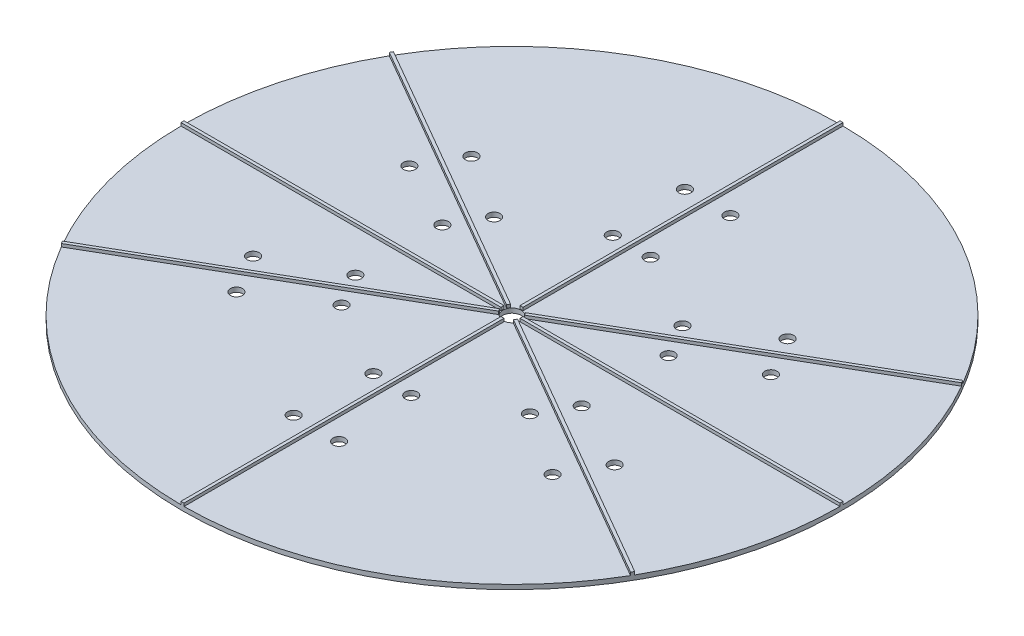
from build123d import *

# Parameters (mm, degrees)
SKETCH1_R           = 217.5
SKETCH1_R_2         = 4
SKETCH1_R_3         = 6
BOSS_EXTRUDE1_DEPTH = 2.5
CUT_EXTRUDE1_START  = -2
SKETCH2_R           = 4
SKETCH2_R_2         = 6
CUT_EXTRUDE1_DEPTH  = 2


with BuildPart() as part:
    # Sketch1 → Boss-Extrude1 (new, symmetric)
    with BuildSketch(Plane(origin=(0, 0, 0), x_dir=(1, 0, 0), z_dir=(0, 1, 0))):
        with Locations(Location((0, 0, 0), (0, 0, 270))):
            Circle(SKETCH1_R)
        with Locations(Location((-12.5, 79.017403146, 0), (0, 0, 270))):
            Circle(SKETCH1_R_2, mode=Mode.SUBTRACT)
        with Locations(Location((12.5, 79.017403146, 0), (0, 0, 270))):
            Circle(SKETCH1_R_2, mode=Mode.SUBTRACT)
        with Locations(Location((62.181078466, 50.334019121, 0), (0, 0, 270))):
            Circle(SKETCH1_R_2, mode=Mode.SUBTRACT)
        with Locations(Location((74.681078466, 28.683384026, 0), (0, 0, 270))):
            Circle(SKETCH1_R_2, mode=Mode.SUBTRACT)
        with Locations(Location((74.681078466, -28.683384026, 0), (0, 0, 270))):
            Circle(SKETCH1_R_2, mode=Mode.SUBTRACT)
        with Locations(Location((62.181078466, -50.334019121, 0), (0, 0, 270))):
            Circle(SKETCH1_R_2, mode=Mode.SUBTRACT)
        with Locations(Location((12.5, -79.017403146, 0), (0, 0, 270))):
            Circle(SKETCH1_R_2, mode=Mode.SUBTRACT)
        with Locations(Location((-12.5, -79.017403146, 0), (0, 0, 270))):
            Circle(SKETCH1_R_2, mode=Mode.SUBTRACT)
        with Locations(Location((-62.181078466, -50.334019121, 0), (0, 0, 270))):
            Circle(SKETCH1_R_2, mode=Mode.SUBTRACT)
        with Locations(Location((-74.681078466, -28.683384026, 0), (0, 0, 270))):
            Circle(SKETCH1_R_2, mode=Mode.SUBTRACT)
        with Locations(Location((-74.681078466, 28.683384026, 0), (0, 0, 270))):
            Circle(SKETCH1_R_2, mode=Mode.SUBTRACT)
        with Locations(Location((-62.181078466, 50.334019121, 0), (0, 0, 270))):
            Circle(SKETCH1_R_2, mode=Mode.SUBTRACT)
        with Locations(Location((15, 129.131715701, 0), (0, 0, 270))):
            Circle(SKETCH1_R_2, mode=Mode.SUBTRACT)
        with Locations(Location((-15, 129.131715701, 0), (0, 0, 90))):
            Circle(SKETCH1_R_2, mode=Mode.SUBTRACT)
        with Locations(Location((104.331346232, 77.556238907, 0), (0, 0, 90))):
            Circle(SKETCH1_R_2, mode=Mode.SUBTRACT)
        with Locations(Location((119.331346232, 51.575476794, 0), (0, 0, 270))):
            Circle(SKETCH1_R_2, mode=Mode.SUBTRACT)
        with Locations(Location((119.331346232, -51.575476794, 0), (0, 0, 90))):
            Circle(SKETCH1_R_2, mode=Mode.SUBTRACT)
        with Locations(Location((104.331346232, -77.556238907, 0), (0, 0, 270))):
            Circle(SKETCH1_R_2, mode=Mode.SUBTRACT)
        with Locations(Location((15, -129.131715701, 0), (0, 0, 90))):
            Circle(SKETCH1_R_2, mode=Mode.SUBTRACT)
        with Locations(Location((-15, -129.131715701, 0), (0, 0, 270))):
            Circle(SKETCH1_R_2, mode=Mode.SUBTRACT)
        with Locations(Location((-104.331346232, -77.556238907, 0), (0, 0, 90))):
            Circle(SKETCH1_R_2, mode=Mode.SUBTRACT)
        with Locations(Location((-119.331346232, -51.575476794, 0), (0, 0, 270))):
            Circle(SKETCH1_R_2, mode=Mode.SUBTRACT)
        with Locations(Location((-119.331346232, 51.575476794, 0), (0, 0, 90))):
            Circle(SKETCH1_R_2, mode=Mode.SUBTRACT)
        with Locations(Location((-104.331346232, 77.556238907, 0), (0, 0, 270))):
            Circle(SKETCH1_R_2, mode=Mode.SUBTRACT)
        with Locations(Location((0, 0, 0), (0, 0, 270))):
            Circle(SKETCH1_R_3, mode=Mode.SUBTRACT)
    extrude(amount=BOSS_EXTRUDE1_DEPTH, both=True)

    # Sketch2 → Cut-Extrude1 (cut)
    with BuildSketch(Plane(origin=(0, 2.5, 0), x_dir=(1, 0, 0), z_dir=(0, 1, 0)).offset(CUT_EXTRUDE1_START)):
        with BuildLine():
            ThreePointArc((-217.497701137, -1), (-210.088867218, -56.29314231), (-188.85853445, -107.882825165))
            Line((-188.85853445, -107.882825165), (-5.888022785, -2.244751001))
            ThreePointArc((-5.888022785, -2.244751001), (-5.457177799, -3.150703071), (-4.888022785, -3.976801809))
            Line((-4.888022785, -3.976801809), (-187.85853445, -109.614875972))
            ThreePointArc((-187.85853445, -109.614875972), (-108.75, -188.360525323), (-1, -217.497701137))
            Line((-1, -217.497701137), (-1, -6.22155281))
            ThreePointArc((-1, -6.22155281), (0, -6.301406142), (1, -6.22155281))
            Line((1, -6.22155281), (1, -217.497701137))
            ThreePointArc((1, -217.497701137), (108.75, -188.360525323), (187.85853445, -109.614875972))
            Line((187.85853445, -109.614875972), (4.888022785, -3.976801809))
            ThreePointArc((4.888022785, -3.976801809), (5.457177799, -3.150703071), (5.888022785, -2.244751001))
            Line((5.888022785, -2.244751001), (188.85853445, -107.882825165))
            ThreePointArc((188.85853445, -107.882825165), (210.088867218, -56.29314231), (217.497701137, -1))
            Line((217.497701137, -1), (6.22155281, -1))
            ThreePointArc((6.22155281, -1), (6.301406142, 0), (6.22155281, 1))
            Line((6.22155281, 1), (217.497701137, 1))
            ThreePointArc((217.497701137, 1), (210.088867218, 56.29314231), (188.85853445, 107.882825165))
            Line((188.85853445, 107.882825165), (5.888022785, 2.244751001))
            ThreePointArc((5.888022785, 2.244751001), (5.457177799, 3.150703071), (4.888022785, 3.976801809))
            Line((4.888022785, 3.976801809), (187.85853445, 109.614875972))
            ThreePointArc((187.85853445, 109.614875972), (108.75, 188.360525323), (1, 217.497701137))
            Line((1, 217.497701137), (1, 6.22155281))
            ThreePointArc((1, 6.22155281), (0, 6.301406142), (-1, 6.22155281))
            Line((-1, 6.22155281), (-1, 217.497701137))
            ThreePointArc((-1, 217.497701137), (-108.75, 188.360525323), (-187.85853445, 109.614875972))
            Line((-187.85853445, 109.614875972), (-4.888022785, 3.976801809))
            ThreePointArc((-4.888022785, 3.976801809), (-5.457177799, 3.150703071), (-5.888022785, 2.244751001))
            Line((-5.888022785, 2.244751001), (-188.85853445, 107.882825165))
            ThreePointArc((-188.85853445, 107.882825165), (-210.088867218, 56.29314231), (-217.497701137, 1))
            Line((-217.497701137, 1), (-6.22155281, 1))
            ThreePointArc((-6.22155281, 1), (-6.301406142, 0), (-6.22155281, -1))
            Line((-6.22155281, -1), (-217.497701137, -1))
        make_face()
        with Locations(Location((-15, -129.131715701, 0), (0, 0, 270))):
            Circle(SKETCH2_R, mode=Mode.SUBTRACT)
        with Locations(Location((-119.331346232, -51.575476794, 0), (0, 0, 270))):
            Circle(SKETCH2_R, mode=Mode.SUBTRACT)
        with Locations(Location((-104.331346232, -77.556238907, 0), (0, 0, 90))):
            Circle(SKETCH2_R, mode=Mode.SUBTRACT)
        with Locations(Location((-12.5, -79.017403146, 0), (0, 0, 270))):
            Circle(SKETCH2_R, mode=Mode.SUBTRACT)
        with Locations(Location((-62.181078466, -50.334019121, 0), (0, 0, 270))):
            Circle(SKETCH2_R, mode=Mode.SUBTRACT)
        with Locations(Location((-74.681078466, -28.683384026, 0), (0, 0, 270))):
            Circle(SKETCH2_R, mode=Mode.SUBTRACT)
        with Locations(Location((15, -129.131715701, 0), (0, 0, 90))):
            Circle(SKETCH2_R, mode=Mode.SUBTRACT)
        with Locations(Location((12.5, -79.017403146, 0), (0, 0, 270))):
            Circle(SKETCH2_R, mode=Mode.SUBTRACT)
        with Locations(Location((104.331346232, -77.556238907, 0), (0, 0, 270))):
            Circle(SKETCH2_R, mode=Mode.SUBTRACT)
        with Locations(Location((62.181078466, -50.334019121, 0), (0, 0, 270))):
            Circle(SKETCH2_R, mode=Mode.SUBTRACT)
        with Locations(Location((74.681078466, -28.683384026, 0), (0, 0, 270))):
            Circle(SKETCH2_R, mode=Mode.SUBTRACT)
        with Locations(Location((119.331346232, -51.575476794, 0), (0, 0, 90))):
            Circle(SKETCH2_R, mode=Mode.SUBTRACT)
        with Locations(Location((-119.331346232, 51.575476794, 0), (0, 0, 90))):
            Circle(SKETCH2_R, mode=Mode.SUBTRACT)
        with Locations(Location((-74.681078466, 28.683384026, 0), (0, 0, 270))):
            Circle(SKETCH2_R, mode=Mode.SUBTRACT)
        with Locations(Location((-62.181078466, 50.334019121, 0), (0, 0, 270))):
            Circle(SKETCH2_R, mode=Mode.SUBTRACT)
        with Locations(Location((-104.331346232, 77.556238907, 0), (0, 0, 270))):
            Circle(SKETCH2_R, mode=Mode.SUBTRACT)
        with Locations(Location((-12.5, 79.017403146, 0), (0, 0, 270))):
            Circle(SKETCH2_R, mode=Mode.SUBTRACT)
        with Locations(Location((-15, 129.131715701, 0), (0, 0, 90))):
            Circle(SKETCH2_R, mode=Mode.SUBTRACT)
        with Locations(Location((0, 0, 0), (0, 0, 270))):
            Circle(SKETCH2_R_2, mode=Mode.SUBTRACT)
        with Locations(Location((74.681078466, 28.683384026, 0), (0, 0, 270))):
            Circle(SKETCH2_R, mode=Mode.SUBTRACT)
        with Locations(Location((62.181078466, 50.334019121, 0), (0, 0, 270))):
            Circle(SKETCH2_R, mode=Mode.SUBTRACT)
        with Locations(Location((12.5, 79.017403146, 0), (0, 0, 270))):
            Circle(SKETCH2_R, mode=Mode.SUBTRACT)
        with Locations(Location((104.331346232, 77.556238907, 0), (0, 0, 90))):
            Circle(SKETCH2_R, mode=Mode.SUBTRACT)
        with Locations(Location((119.331346232, 51.575476794, 0), (0, 0, 270))):
            Circle(SKETCH2_R, mode=Mode.SUBTRACT)
        with Locations(Location((15, 129.131715701, 0), (0, 0, 270))):
            Circle(SKETCH2_R, mode=Mode.SUBTRACT)
    extrude(amount=CUT_EXTRUDE1_DEPTH, mode=Mode.SUBTRACT)


solid = part.part
